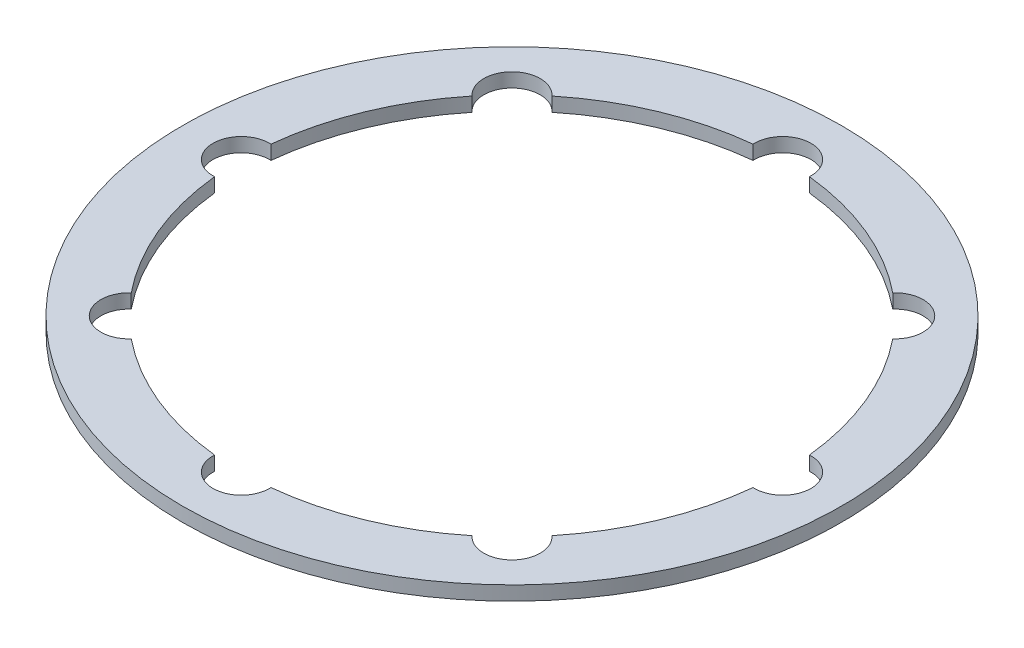
from build123d import *

# Parameters (mm, degrees)
SKETCH_1_R      = 70
EXTRUDE_1_DEPTH = 3


with BuildPart() as part:
    # Эскиз1 → Бобышка-Вытянуть1 (new body)
    with BuildSketch(Plane(origin=(0, 0, 0), x_dir=(1, 0, 0), z_dir=(0, 1, 0))):
        with Locations(Location((0, 0, 0), (0, 0, 270))):
            Circle(SKETCH_1_R)
        with BuildLine():
            ThreePointArc((-5.991828083, 57.186956522), (-22.004297361, 53.123073119), (-36.200422482, 44.674147021))
            ThreePointArc((-36.200422482, 44.674147021), (-44.901280605, 44.901280605), (-44.674147021, 36.200422482))
            ThreePointArc((-44.674147021, 36.200422482), (-53.123073119, 22.004297361), (-57.186956522, 5.991828083))
            ThreePointArc((-57.186956522, 5.991828083), (-63.5, 0), (-57.186956522, -5.991828083))
            ThreePointArc((-57.186956522, -5.991828083), (-53.123073119, -22.004297361), (-44.674147021, -36.200422482))
            ThreePointArc((-44.674147021, -36.200422482), (-44.901280605, -44.901280605), (-36.200422482, -44.674147021))
            ThreePointArc((-36.200422482, -44.674147021), (-22.004297361, -53.123073119), (-5.991828083, -57.186956522))
            ThreePointArc((-5.991828083, -57.186956522), (0, -63.5), (5.991828083, -57.186956522))
            ThreePointArc((5.991828083, -57.186956522), (22.004297361, -53.123073119), (36.200422482, -44.674147021))
            ThreePointArc((36.200422482, -44.674147021), (44.901280605, -44.901280605), (44.674147021, -36.200422482))
            ThreePointArc((44.674147021, -36.200422482), (53.123073119, -22.004297361), (57.186956522, -5.991828083))
            ThreePointArc((57.186956522, -5.991828083), (63.5, 0), (57.186956522, 5.991828083))
            ThreePointArc((57.186956522, 5.991828083), (53.123073119, 22.004297361), (44.674147021, 36.200422482))
            ThreePointArc((44.674147021, 36.200422482), (44.901280605, 44.901280605), (36.200422482, 44.674147021))
            ThreePointArc((36.200422482, 44.674147021), (22.004297361, 53.123073119), (5.991828083, 57.186956522))
            ThreePointArc((5.991828083, 57.186956522), (0, 63.5), (-5.991828083, 57.186956522))
        make_face(mode=Mode.SUBTRACT)
    extrude(amount=EXTRUDE_1_DEPTH)


solid = part.part
